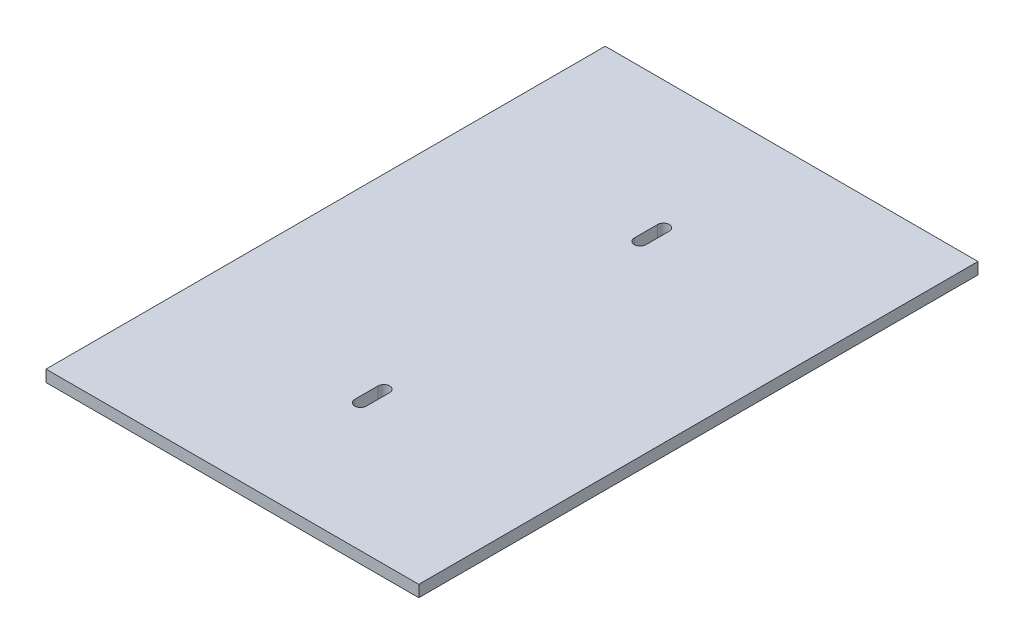
from build123d import *

# Parameters (mm, degrees)
SKETCH1_W           = 203.2
SKETCH1_H           = 304.8
BOSS_EXTRUDE1_DEPTH = 6.35


with BuildPart() as part:
    # Sketch1 → Boss-Extrude1 (new body)
    with BuildSketch(Plane(origin=(0, 0, 0), x_dir=(1, 0, 0), z_dir=(0, 1, 0))):
        Rectangle(SKETCH1_W, SKETCH1_H)
        with BuildLine():
            Line((3.175, -69.85), (3.175, -82.55))
            ThreePointArc((3.175, -82.55), (0, -85.725), (-3.175, -82.55))
            Line((-3.175, -82.55), (-3.175, -69.85))
            ThreePointArc((-3.175, -69.85), (0, -66.675), (3.175, -69.85))
        make_face(mode=Mode.SUBTRACT)
        with BuildLine():
            Line((3.175, 69.85), (3.175, 82.55))
            ThreePointArc((3.175, 82.55), (0, 85.725), (-3.175, 82.55))
            Line((-3.175, 82.55), (-3.175, 69.85))
            ThreePointArc((-3.175, 69.85), (0, 66.675), (3.175, 69.85))
        make_face(mode=Mode.SUBTRACT)
    extrude(amount=BOSS_EXTRUDE1_DEPTH)


solid = part.part
